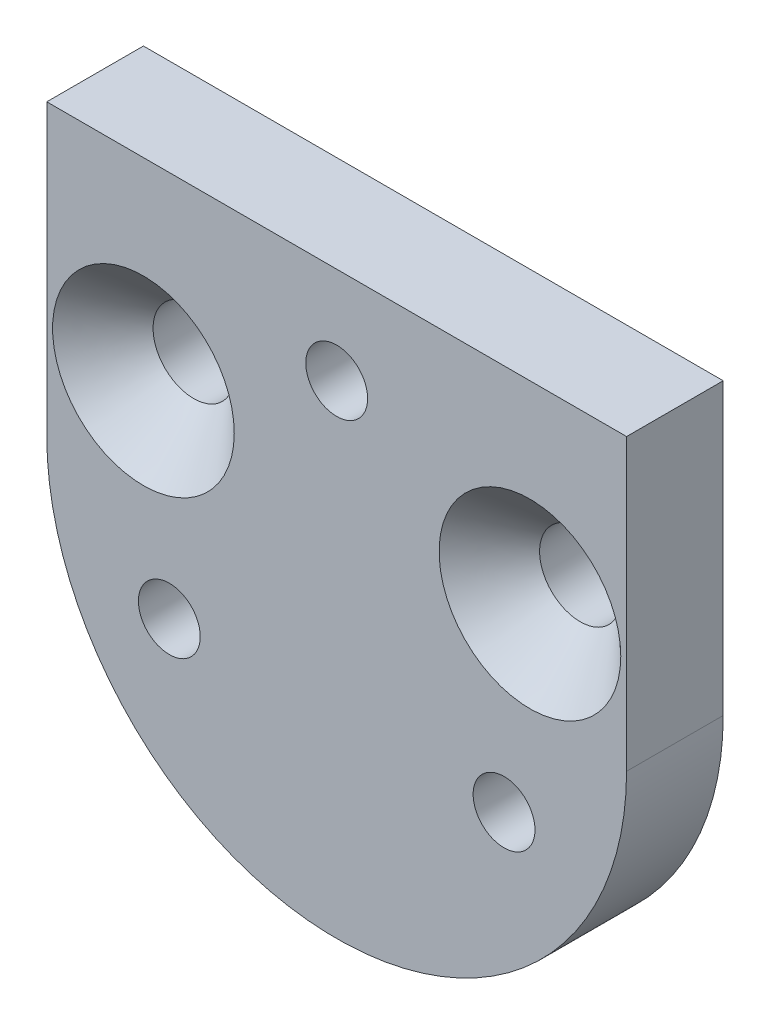
from build123d import *

# Parameters (mm, degrees)
EXTRUDE_1_DEPTH             = 5
SKETCH_2_R                  = 1.6
CUT_EXTRUDE_1_DEPTH         = 22.794494718
HOLE_WIZARD_M41_D           = 4.2
HOLE_WIZARD_M41_DEPTH       = 8.5
HOLE_WIZARD_M41_CSINK_D     = 9.4
HOLE_WIZARD_M41_CSINK_ANGLE = 90
HOLE_WIZARD_M41_TIP         = 1.2618073
CUT_EXTRUDE_2_DEPTH         = 2.6


with BuildPart() as part:
    # Эскиз1 → Бобышка-Вытянуть1 (new body)
    with BuildSketch(Plane.XY):
        with BuildLine():
            Line((-15, 15), (15, 15))
            Line((15, 15), (15, 0))
            ThreePointArc((15, 0), (0, -15), (-15, 0))
            Line((-15, 0), (-15, 15))
        make_face()
    extrude(amount=EXTRUDE_1_DEPTH)

    # Эскиз2 → Вырез-Вытянуть1 (cut, through all)
    with BuildSketch(Plane.XY.offset(5)):
        with Locations((0, 10)):
            Circle(SKETCH_2_R)
        with Locations((8.660254038, -5)):
            Circle(SKETCH_2_R)
        with Locations((-8.660254038, -5)):
            Circle(SKETCH_2_R)
    extrude(amount=-CUT_EXTRUDE_1_DEPTH, mode=Mode.SUBTRACT)

    # Зенковка для винта с полупотайной головкой M41
    with Locations(Plane(origin=(-10, 5, 5), x_dir=(1, 0, 0), z_dir=(0, 0, 1))):
        with Locations((0, 0), (20, 0)):
            CounterSinkHole(HOLE_WIZARD_M41_D / 2, HOLE_WIZARD_M41_CSINK_D / 2, depth=HOLE_WIZARD_M41_DEPTH, counter_sink_angle=HOLE_WIZARD_M41_CSINK_ANGLE)
            with Locations((0, 0, -(HOLE_WIZARD_M41_DEPTH + HOLE_WIZARD_M41_TIP / 2))):  # 118° drill point
                Cone(0, HOLE_WIZARD_M41_D / 2, HOLE_WIZARD_M41_TIP, mode=Mode.SUBTRACT)

    # Эскиз4 → Вырез-Вытянуть2 (cut)
    with BuildSketch(Plane(origin=(0, 0, 0), x_dir=(-1, 0, 0), z_dir=(0, 0, -1))):
        Polygon((3.233161507, 10), (1.616580754, 12.8), (-1.616580754, 12.8), (-3.233161507, 10), (-1.616580754, 7.2), (1.616580754, 7.2), align=None)
        Polygon((11.893415545, -5), (10.276834792, -2.2), (7.043673284, -2.2), (5.42709253, -5), (7.043673284, -7.8), (10.276834792, -7.8), align=None)
        Polygon((-5.42709253, -5), (-7.043673284, -2.2), (-10.276834792, -2.2), (-11.893415545, -5), (-10.276834792, -7.8), (-7.043673284, -7.8), align=None)
    extrude(amount=-CUT_EXTRUDE_2_DEPTH, mode=Mode.SUBTRACT)


solid = part.part
